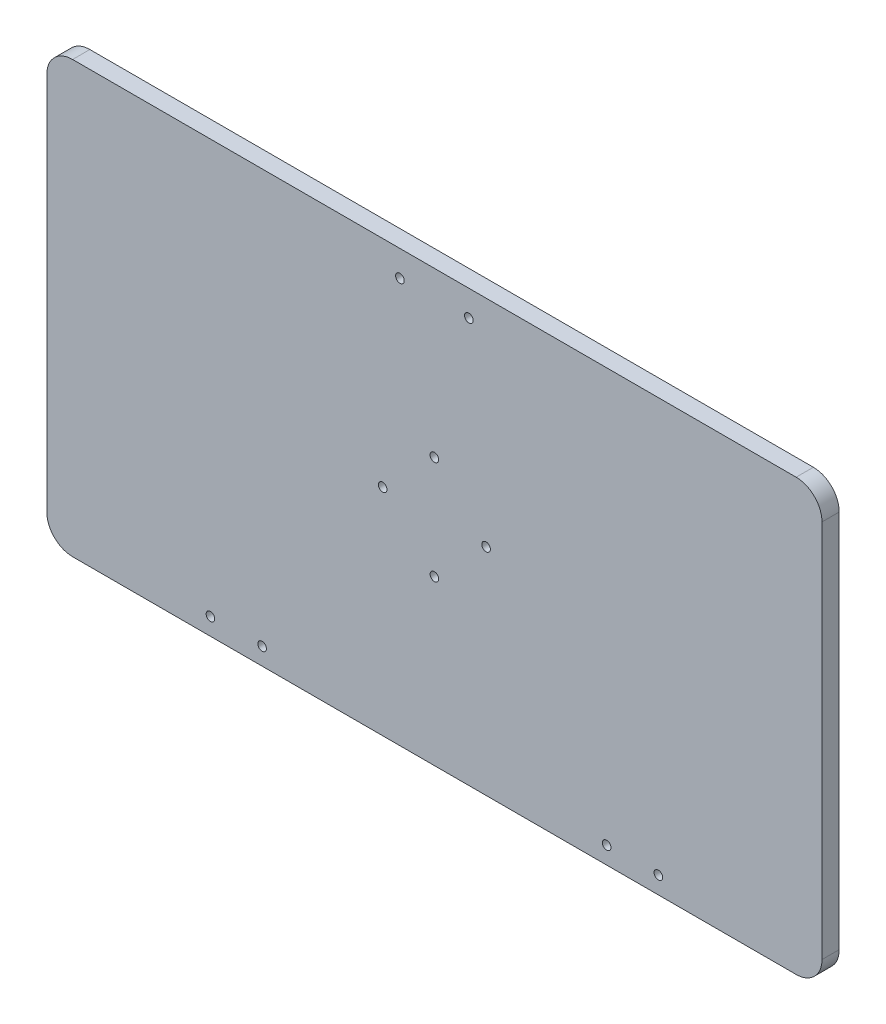
from build123d import *

# Parameters (mm, degrees)
CROQUIS1_R              = 2.5
SALIENTE_EXTRUIR1_DEPTH = 10


with BuildPart() as part:
    # Croquis1 → Saliente-Extruir1 (new body)
    with BuildSketch(Plane.XY):
        with BuildLine():
            Line((15, 0), (435, 0))
            ThreePointArc((435, 0), (445.606601718, 4.393398282), (450, 15))
            Line((450, 15), (450, 235))
            ThreePointArc((450, 235), (445.606601718, 245.606601718), (435, 250))
            Line((435, 250), (15, 250))
            ThreePointArc((15, 250), (4.393398282, 245.606601718), (0, 235))
            Line((0, 235), (0, 15))
            ThreePointArc((0, 15), (4.393398282, 4.393398282), (15, 0))
        make_face()
        with Locations((205, 235)):
            Circle(CROQUIS1_R, mode=Mode.SUBTRACT)
        with Locations((245, 235)):
            Circle(CROQUIS1_R, mode=Mode.SUBTRACT)
        with Locations((325, 10)):
            Circle(CROQUIS1_R, mode=Mode.SUBTRACT)
        with Locations((355, 10)):
            Circle(CROQUIS1_R, mode=Mode.SUBTRACT)
        with Locations(Location((95, 10, 0), (0, 0, 180))):
            Circle(CROQUIS1_R, mode=Mode.SUBTRACT)
        with Locations(Location((125, 10, 0), (0, 0, 180))):
            Circle(CROQUIS1_R, mode=Mode.SUBTRACT)
        with Locations((255, 125)):
            Circle(CROQUIS1_R, mode=Mode.SUBTRACT)
        with Locations((225, 95)):
            Circle(CROQUIS1_R, mode=Mode.SUBTRACT)
        with Locations((195, 125)):
            Circle(CROQUIS1_R, mode=Mode.SUBTRACT)
        with Locations((225, 155)):
            Circle(CROQUIS1_R, mode=Mode.SUBTRACT)
    extrude(amount=SALIENTE_EXTRUIR1_DEPTH)


solid = part.part
